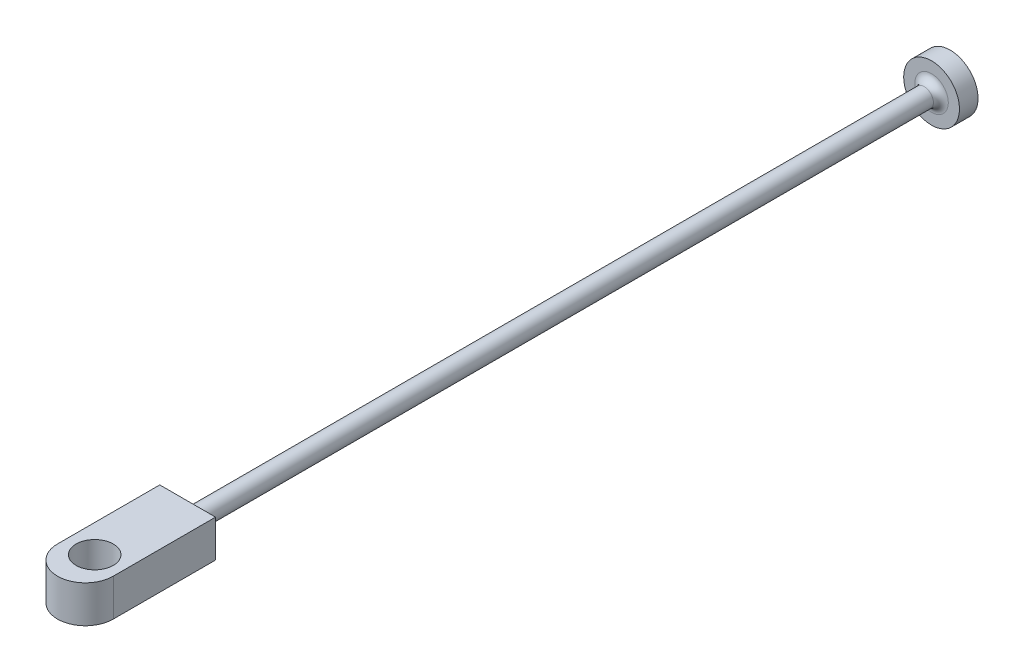
from build123d import *

# Parameters (mm, degrees)
BOSS_EXTRUDE1_DEPTH      = 165
BOSS_EXTRUDE1_DEPTH_BACK = 35
SKETCH1_R                = 2.5
SKETCH2_W                = 15
SKETCH2_H                = 10
BOSS_EXTRUDE2_DEPTH      = 35
SKETCH3_R                = 5
CUT_EXTRUDE1_DEPTH       = 209.3416665
FILLET1_RADIUS           = 7.5
FILLET1_LENGTH           = 10
FILLET2_R                = 2
SKETCH4_R                = 7.5
BOSS_EXTRUDE3_DEPTH      = 5
FILLET3_R                = 2


with BuildPart() as part:
    # Sketch1 → Boss-Extrude1 (new, two sides: drawn at the far end of the back side and taken through both)
    with BuildSketch(Plane.XY.offset(-BOSS_EXTRUDE1_DEPTH_BACK)):
        with Locations((50, 0)):
            Circle(SKETCH1_R)
    extrude(amount=BOSS_EXTRUDE1_DEPTH + BOSS_EXTRUDE1_DEPTH_BACK)

    # Sketch2 → Boss-Extrude2 (add)
    with BuildSketch(Plane.XY.offset(165)):
        with Locations((50, 0)):
            Rectangle(SKETCH2_W, SKETCH2_H)
    extrude(amount=BOSS_EXTRUDE2_DEPTH)

    # Sketch3 → Cut-Extrude1 (cut, through all)
    with BuildSketch(Plane(origin=(0, 5, 0), x_dir=(1, 0, 0), z_dir=(0, 1, 0))):
        with Locations(Location((50, -190, 0), (0, 0, 270))):
            Circle(SKETCH3_R)
    extrude(amount=-CUT_EXTRUDE1_DEPTH, mode=Mode.SUBTRACT)

    # Fillet1: full round fillet: the end face becomes a half cylinder, R = half its width
    fillet1_face = Plane((50, 0, 200), x_dir=(0, -1, 0), z_dir=(0, 0, 1))  # on the end face: x along it, z out of the body
    fillet1_slab = fillet1_face.offset(-FILLET1_RADIUS / 2) * Box(FILLET1_LENGTH, 2 * FILLET1_RADIUS, FILLET1_RADIUS, mode=Mode.PRIVATE)  # the body's end, R deep
    fillet1_round = Plane((50, 0, 192.5), x_dir=(0, 0, 1), z_dir=(0, -1, 0)) * Cylinder(FILLET1_RADIUS, FILLET1_LENGTH, mode=Mode.PRIVATE)  # its axis R under the face
    add(fillet1_slab - fillet1_round, mode=Mode.SUBTRACT)

    # Fillet2
    fillet2_edges = [part.edges().sort_by_distance(p)[0] for p in [
        (47.5, 0, 165),
    ]]
    fillet(fillet2_edges, radius=FILLET2_R)

    # Sketch4 → Boss-Extrude3 (add)
    with BuildSketch(Plane(origin=(0, 0, -35), x_dir=(-1, 0, 0), z_dir=(0, 0, -1))):
        with Locations((-50, 0)):
            Circle(SKETCH4_R)
    extrude(amount=BOSS_EXTRUDE3_DEPTH)

    # Fillet3
    fillet3_edges = [part.edges().sort_by_distance(p)[0] for p in [
        (47.5, 0, -35),
    ]]
    fillet(fillet3_edges, radius=FILLET3_R)


solid = part.part
